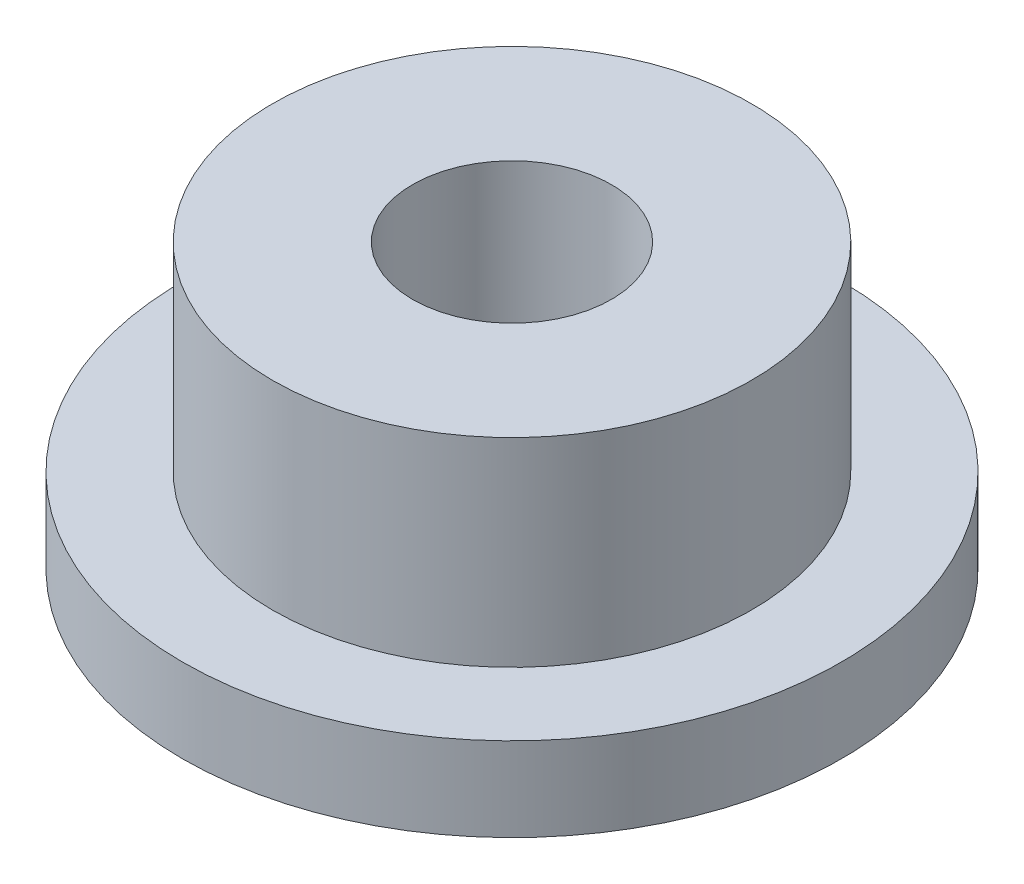
from build123d import *

# Parameters (mm, degrees)
SKETCH7_W = 6.35
SKETCH7_H = 6.35


with BuildPart() as part:
    # Sketch5 → Revolve2 (revolve)
    with BuildSketch(Plane(origin=(0, 0, 0), x_dir=(-1, 0, 0), z_dir=(0, 0, -1)), mode=Mode.PRIVATE) as revolve2_sk:
        Polygon((-21.034375, 1), (-8.5, 1), (-8.5, 0), (-6.35, 0), (-6.35, 19.05), (-15.2908, 19.05), (-15.2908, 6.35), (-21.034375, 6.35), align=None)
    revolve(revolve2_sk.sketch.rotate(Axis((0, 0, 0), (0, 1, 0)), 270), axis=Axis((0, 0, 0), (0, 1, 0)))


with BuildPart() as body_2:
    # Sketch7 → Revolve3 (revolve)
    with BuildSketch(Plane.XY, mode=Mode.PRIVATE) as revolve3_sk:
        with Locations((3.175, -3.175)):
            Rectangle(SKETCH7_W, SKETCH7_H)
    revolve(revolve3_sk.sketch.rotate(Axis((0, 0, 0), (0, -1, 0)), 270), axis=Axis((0, 0, 0), (0, -1, 0)))


solid = Compound([part.part, body_2.part])
